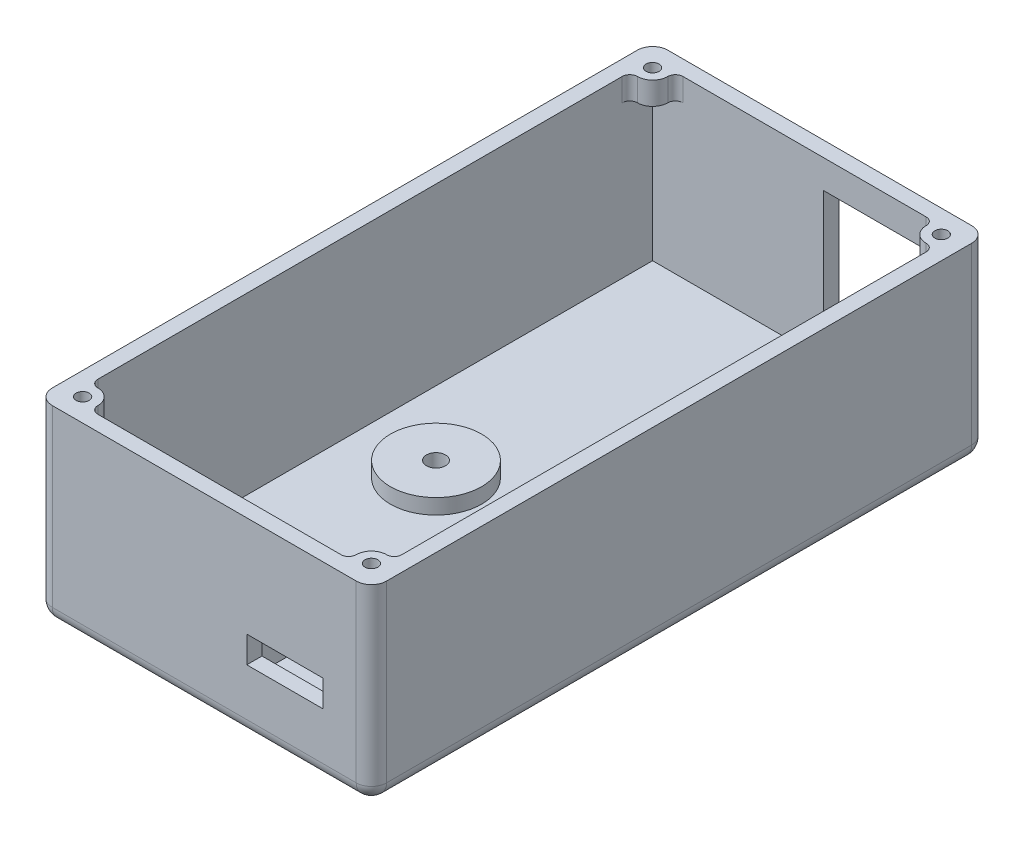
from build123d import *

# Parameters (mm, degrees)
SKETCH_1_W           = 44
SKETCH_1_H           = 81
EXTRUDE_1_DEPTH      = 25
SHELL_1_T            = -2
FILLET_1_R           = 2
SKETCH_2_R           = 0.8
SKETCH_2_R_2         = 0.9
CUT_EXTRUDE_1_DEPTH  = 24
SKETCH_3_R           = 1.25
CUT_EXTRUDE_2_DEPTH  = 24
SKETCH_4_R           = 6
EXTRUDE_2_DEPTH      = 2
CUT_EXTRUDE_START    = -13.2
SKETCH_6_R           = 1.25
CUT_EXTRUDE_4_DEPTH  = 13.2
SKETCH_7_W           = 15.5
SKETCH_7_H           = 17.5
CUT_EXTRUDE_5_DEPTH  = 13.2
SKETCH_9_W           = 18.8
SKETCH_9_H           = 6.5
SKETCH_9_R           = 0.9
EXTRUDE_3_DEPTH      = 8
SKETCH_11_W          = 11
SKETCH_11_H          = 6.5
CUT_EXTRUDE_6_DEPTH  = 4
SKETCH_12_W          = 10
SKETCH_12_H          = 3.5
CUT_EXTRUDE_7_DEPTH  = 4
FILLET_2_R           = 2
EXTRUDE_START        = -1
SKETCH_14_R          = 1.25
EXTRUDE_4_DEPTH      = 1
SKETCH_15_R          = 2
CUT_EXTRUDE_8_DEPTH  = 1
SKETCH_17_R          = 2
EXTRUDE_5_DEPTH      = 3
SKETCH_18_R          = 0.85
CUT_EXTRUDE_10_DEPTH = 3
FILLET_4_R           = 1


with BuildPart() as part:
    # 草图1 → 凸台-拉伸1 (new body)
    with BuildSketch(Plane(origin=(0, 0, 0), x_dir=(1, 0, 0), z_dir=(0, 1, 0))):
        with Locations((0, -2.5)):
            Rectangle(SKETCH_1_W, SKETCH_1_H)
    extrude(amount=EXTRUDE_1_DEPTH)

    # 抽壳1
    shell_1_openings = [part.faces().sort_by_distance(p)[0] for p in [
        (0, 25, 2.5),
    ]]
    offset(amount=SHELL_1_T, openings=shell_1_openings, kind=Kind.INTERSECTION)

    # 圆角1
    fillet_1_edges = [part.edges().sort_by_distance(p)[0] for p in [
        (0, 0, -38),
        (22, 0, 2.5),
        (0, 0, 43),
        (-22, 0, 2.5),
        (-22, 12.5, -38),
        (22, 12.5, -38),
        (22, 12.5, 43),
        (-22, 12.5, 43),
    ]]
    fillet(fillet_1_edges, radius=FILLET_1_R)

    # 草图2 → 切除-拉伸1 (cut)
    with BuildSketch(Plane(origin=(0, 2, 0), x_dir=(1, 0, 0), z_dir=(0, 1, 0))):
        with Locations(Location((4.8, 16.9, 0), (0, 0, 270))):
            Circle(SKETCH_2_R)
        with Locations(Location((16.1, -9.5, 0), (0, 0, 270))):
            Circle(SKETCH_2_R_2)
    extrude(amount=-CUT_EXTRUDE_1_DEPTH, mode=Mode.SUBTRACT)

    # 草图3 → 切除-拉伸2 (cut)
    with BuildSketch(Plane(origin=(0, 2, 0), x_dir=(1, 0, 0), z_dir=(0, 1, 0))):
        with Locations(Location((-9.5, -3, 0), (0, 0, 270))):
            Circle(SKETCH_3_R)
    extrude(amount=-CUT_EXTRUDE_2_DEPTH, mode=Mode.SUBTRACT)

    # 草图4 → 凸台-拉伸2 (add)
    with BuildSketch(Plane(origin=(0, 2, 0), x_dir=(1, 0, 0), z_dir=(0, 1, 0))):
        with Locations(Location((-9.5, -3, 0), (0, 0, 270))):
            Circle(SKETCH_4_R)
    extrude(amount=EXTRUDE_2_DEPTH)

    # 草图6 → 切除-拉伸4 (cut)
    with BuildSketch(Plane.XZ.offset(CUT_EXTRUDE_START)):
        with Locations(Location((-9.5, 3, 0), (0, 0, 90))):
            Circle(SKETCH_6_R)
    extrude(amount=CUT_EXTRUDE_4_DEPTH, mode=Mode.SUBTRACT)

    # 草图7 → 切除-拉伸5 (cut)
    with BuildSketch(Plane(origin=(0, 0, -38), x_dir=(-1, 0, 0), z_dir=(0, 0, -1))):
        with Locations((-10.25, 12.5)):
            Rectangle(SKETCH_7_W, SKETCH_7_H)
    extrude(amount=-CUT_EXTRUDE_5_DEPTH, mode=Mode.SUBTRACT)

    # 草图9 → 凸台-拉伸3 (add)
    with BuildSketch(Plane(origin=(0, 2, 0), x_dir=(1, 0, 0), z_dir=(0, 1, 0))):
        with Locations((10.6, -37.75)):
            Rectangle(SKETCH_9_W, SKETCH_9_H)
        with Locations(Location((18.1, -37.9, 0), (0, 0, 270))):
            Circle(SKETCH_9_R, mode=Mode.SUBTRACT)
        with Locations(Location((3.1, -37.9, 0), (0, 0, 270))):
            Circle(SKETCH_9_R, mode=Mode.SUBTRACT)
    extrude(amount=EXTRUDE_3_DEPTH)

    # 草图11 → 切除-拉伸6 (cut)
    with BuildSketch(Plane(origin=(0, 10, 0), x_dir=(1, 0, 0), z_dir=(0, 1, 0))):
        with Locations((10.6, -37.75)):
            Rectangle(SKETCH_11_W, SKETCH_11_H)
    extrude(amount=-CUT_EXTRUDE_6_DEPTH, mode=Mode.SUBTRACT)

    # 草图12 → 切除-拉伸7 (cut)
    with BuildSketch(Plane.XY.offset(43)):
        with Locations((10.6, 10)):
            Rectangle(SKETCH_12_W, SKETCH_12_H)
    extrude(amount=-CUT_EXTRUDE_7_DEPTH, mode=Mode.SUBTRACT)

    # 圆角2
    fillet_2_edges = [part.edges().sort_by_distance(p)[0] for p in [
        (10.6, 2, 34.5),
        (1.2, 2, 37.75),
        (1.2, 6, 34.5),
    ]]
    fillet(fillet_2_edges, radius=FILLET_2_R)

    # 草图14 → 凸台-拉伸4 (add)
    with BuildSketch(Plane.XZ.offset(EXTRUDE_START)):
        with Locations(Location((-9.5, 3, 0), (0, 0, 90))):
            Circle(SKETCH_14_R)
    extrude(amount=EXTRUDE_4_DEPTH)

    # 草图15 → 切除-拉伸8 (cut)
    with BuildSketch(Plane.XZ):
        with Locations(Location((16.1, 9.5, 0), (0, 0, 270))):
            Circle(SKETCH_15_R)
        with Locations(Location((4.8, -16.9, 0), (0, 0, 270))):
            Circle(SKETCH_15_R)
    extrude(amount=-CUT_EXTRUDE_8_DEPTH, mode=Mode.SUBTRACT)

    # 草图17 → 凸台-拉伸5 (add)
    with BuildSketch(Plane(origin=(0, 25, 0), x_dir=(1, 0, 0), z_dir=(0, 1, 0))):
        with Locations((19, 35)):
            Circle(SKETCH_17_R)
        with Locations((-19, 35)):
            Circle(SKETCH_17_R)
        with Locations((-19, -40)):
            Circle(SKETCH_17_R)
        with Locations((19, -40)):
            Circle(SKETCH_17_R)
    extrude(amount=-EXTRUDE_5_DEPTH)

    # 草图18 → 切除-拉伸10 (cut)
    with BuildSketch(Plane(origin=(0, 25, 0), x_dir=(1, 0, 0), z_dir=(0, 1, 0))):
        with Locations(Location((19, 35, 0), (0, 0, 270))):
            Circle(SKETCH_18_R)
        with Locations(Location((-19, 35, 0), (0, 0, 90))):
            Circle(SKETCH_18_R)
        with Locations(Location((-19, -40, 0), (0, 0, 270))):
            Circle(SKETCH_18_R)
        with Locations(Location((19, -40, 0), (0, 0, 90))):
            Circle(SKETCH_18_R)
    extrude(amount=-CUT_EXTRUDE_10_DEPTH, mode=Mode.SUBTRACT)

    # 圆角4
    fillet_4_edges = [part.edges().sort_by_distance(p)[0] for p in [
        (17.267949192, 23.5, -36),
        (20, 23.5, -33.267949192),
        (-17.267949192, 23.5, -36),
        (-20, 23.5, -33.267949192),
        (-20, 23.5, 38.267949192),
        (-17.267949192, 23.5, 41),
        (17.267949192, 23.5, 41),
        (20, 23.5, 38.267949192),
    ]]
    fillet(fillet_4_edges, radius=FILLET_4_R)


solid = part.part
